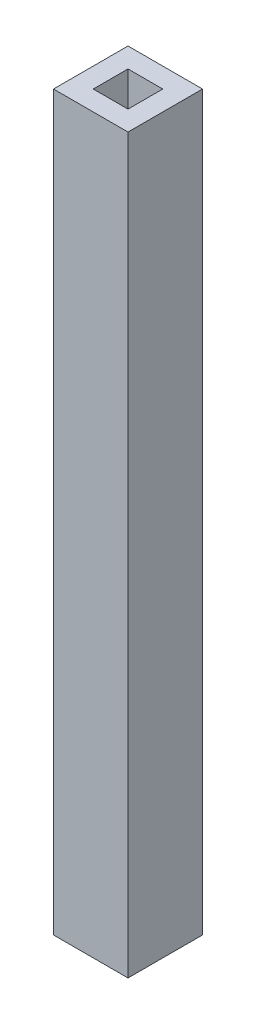
from build123d import *

# Parameters (mm, degrees)
SKETCH2_W           = 19.05
SKETCH2_H           = 19.05
SKETCH2_W_2         = 8.89
SKETCH2_H_2         = 8.89
BOSS_EXTRUDE1_DEPTH = 187.325


with BuildPart() as part:
    # Sketch2 → Boss-Extrude1 (new body)
    with BuildSketch(Plane(origin=(0, 0, 0), x_dir=(1, 0, 0), z_dir=(0, 1, 0))):
        with Locations((-53.868107849, -115.772904755)):
            Rectangle(SKETCH2_W, SKETCH2_H)
        with Locations((-53.868107849, -115.772904755)):
            Rectangle(SKETCH2_W_2, SKETCH2_H_2, mode=Mode.SUBTRACT)
    extrude(amount=BOSS_EXTRUDE1_DEPTH)


solid = part.part
